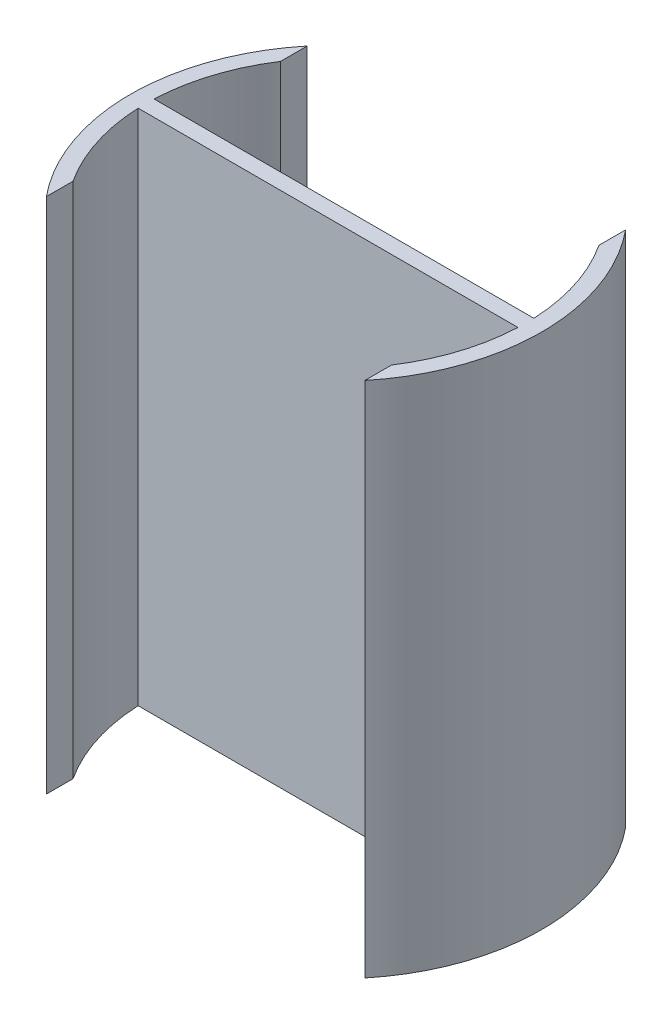
from build123d import *

# Parameters (mm, degrees)
SKETCH2_R           = 25.85
BOSS_EXTRUDE1_DEPTH = 65
CUT_EXTRUDE1_START  = -100
CUT_EXTRUDE1_DEPTH  = 100


with BuildPart() as part:
    # Sketch2 → Boss-Extrude1 (new body)
    with BuildSketch(Plane(origin=(0, 0, 0), x_dir=(1, 0, 0), z_dir=(0, 1, 0))):
        with Locations(Location((0, 0, 0), (0, 0, 270))):
            Circle(SKETCH2_R)
    extrude(amount=BOSS_EXTRUDE1_DEPTH)

    # Sketch4 → Cut-Extrude1 (cut)
    with BuildSketch(Plane(origin=(0, 65, 0), x_dir=(1, 0, 0), z_dir=(0, 1, 0)).offset(CUT_EXTRUDE1_START)):
        with BuildLine():
            Line((-20, 16.377499809), (-20, 13.031596218))
            ThreePointArc((-20, 13.031596218), (0, 23.870955155), (20, 13.031596218))
            Line((20, 13.031596218), (20, 16.377499809))
            ThreePointArc((20, 16.377499809), (0, 25.85), (-20, 16.377499809))
        make_face()
        with BuildLine():
            ThreePointArc((20, 13.031596218), (0, 23.870955155), (-20, 13.031596218))
            Line((-20, 13.031596218), (-20, 11.370955155))
            Line((-20, 11.370955155), (20, 11.370955155))
            Line((20, 11.370955155), (20, 13.031596218))
        make_face()
        with BuildLine():
            ThreePointArc((-20, 13.031596218), (-22.735334875, 7.275097808), (-23.85, 1))
            Line((-23.85, 1), (23.85, 1))
            ThreePointArc((23.85, 1), (22.735334875, 7.275097808), (20, 13.031596218))
            Line((20, 13.031596218), (20, 11.370955155))
            Line((20, 11.370955155), (-20, 11.370955155))
            Line((-20, 11.370955155), (-20, 13.031596218))
        make_face()
        with BuildLine():
            ThreePointArc((-23.85, -1), (-22.735334875, -7.275097808), (-20, -13.031596218))
            Line((-20, -13.031596218), (-20, -11.370955155))
            Line((-20, -11.370955155), (20, -11.370955155))
            Line((20, -11.370955155), (20, -13.031596218))
            ThreePointArc((20, -13.031596218), (22.735334875, -7.275097808), (23.85, -1))
            Line((23.85, -1), (-23.85, -1))
        make_face()
        with BuildLine():
            Line((-20, -11.370955155), (-20, -13.031596218))
            ThreePointArc((-20, -13.031596218), (0, -23.870955155), (20, -13.031596218))
            Line((20, -13.031596218), (20, -11.370955155))
            Line((20, -11.370955155), (-20, -11.370955155))
        make_face()
        with BuildLine():
            Line((-20, -13.031596218), (-20, -16.377499809))
            ThreePointArc((-20, -16.377499809), (0, -25.85), (20, -16.377499809))
            Line((20, -16.377499809), (20, -13.031596218))
            ThreePointArc((20, -13.031596218), (0, -23.870955155), (-20, -13.031596218))
        make_face()
    extrude(amount=CUT_EXTRUDE1_DEPTH, mode=Mode.SUBTRACT)


solid = part.part
